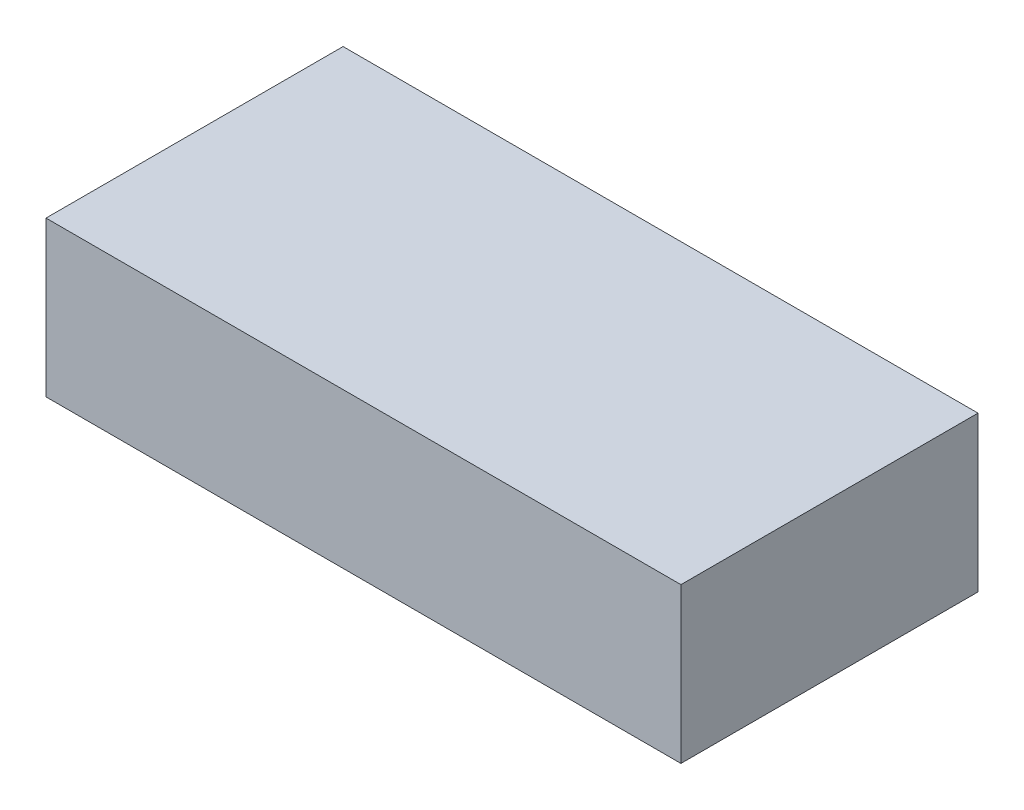
from build123d import *

# Parameters (mm, degrees)
SKETCH1_W           = 89.38
SKETCH1_H           = 41.82
BOSS_EXTRUDE6_DEPTH = 21.8
SKETCH1_13_R        = 2.2
CUT_EXTRUDE2_DEPTH  = 10


with BuildPart() as part:
    # Sketch1 → Boss-Extrude6 (new body)
    with BuildSketch(Plane(origin=(0, 0, 0), x_dir=(1, 0, 0), z_dir=(0, 1, 0))):
        Rectangle(SKETCH1_W, SKETCH1_H)
    extrude(amount=BOSS_EXTRUDE6_DEPTH)

    # Sketch1<13> → Cut-Extrude2 (cut)
    with BuildSketch(Plane(origin=(0, 0, 0), x_dir=(1, 0, 0), z_dir=(0, 1, 0))):
        with Locations((-25.39, 11.93)):
            Circle(SKETCH1_13_R)
        with Locations((-25.39, -11.93)):
            Circle(SKETCH1_13_R)
        with Locations((14.65, 11.93)):
            Circle(SKETCH1_13_R)
        with Locations((14.65, -11.93)):
            Circle(SKETCH1_13_R)
    extrude(amount=CUT_EXTRUDE2_DEPTH, mode=Mode.SUBTRACT)


solid = part.part
